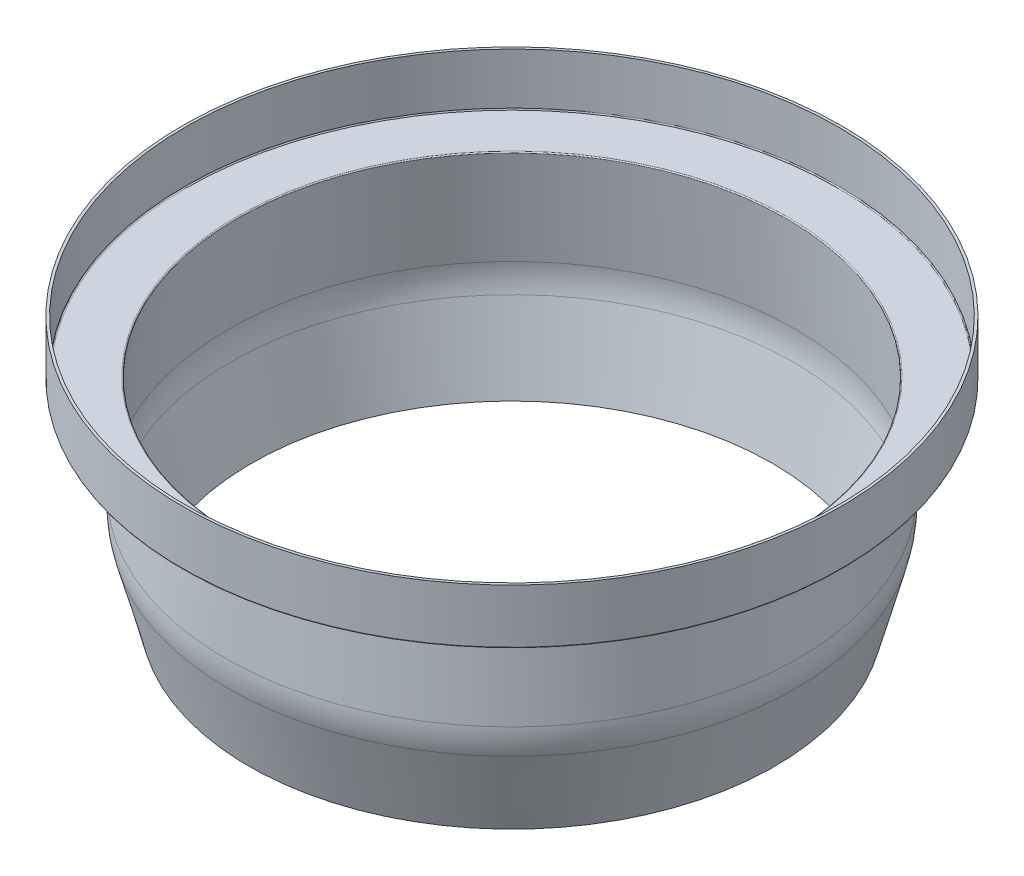
from build123d import *


with BuildPart() as part:
    # Çizim1 → Döndür1 (revolve)
    with BuildSketch(Plane.XY, mode=Mode.PRIVATE) as d_nd_r1_sk:
        with BuildLine():
            Line((-62.624886052, 17.432352941), (-62.624886052, 7.632352941))
            ThreePointArc((-62.624886052, 7.632352941), (-62.566307408, 7.490931585), (-62.424886052, 7.432352941))
            Line((-62.424886052, 7.432352941), (-52.843147752, 7.432352941))
            ThreePointArc((-52.843147752, 7.432352941), (-52.695692285, 7.367470983), (-52.643908812, 7.214921793))
            Line((-52.643908812, 7.214921793), (-54.319118015, -11.932807009))
            ThreePointArc((-54.319118015, -11.932807009), (-54.319118015, -14.547479292), (-53.865084938, -17.122428827))
            Line((-53.865084938, -17.122428827), (-49.890893837, -31.954311932))
            Line((-49.890893837, -31.954311932), (-50.373856751, -32.083721455))
            Line((-50.373856751, -32.083721455), (-54.370866241, -17.166678957))
            ThreePointArc((-54.370866241, -17.166678957), (-54.824899318, -14.591729422), (-54.824899318, -11.977057139))
            Line((-54.824899318, -11.977057139), (-53.189563063, 6.714921793))
            ThreePointArc((-53.189563063, 6.714921793), (-53.241346535, 6.867470983), (-53.388802002, 6.932352941))
            Line((-53.388802002, 6.932352941), (-62.924886052, 6.932352941))
            ThreePointArc((-62.924886052, 6.932352941), (-63.066307408, 6.990931585), (-63.124886052, 7.132352941))
            Line((-63.124886052, 7.132352941), (-63.124886052, 17.432352941))
            Line((-63.124886052, 17.432352941), (-62.624886052, 17.432352941))
        make_face()
    revolve(d_nd_r1_sk.sketch.rotate(Axis((0, 0, 0), (0, 1, 0)), 270), axis=Axis((0, 0, 0), (0, 1, 0)))


solid = part.part
